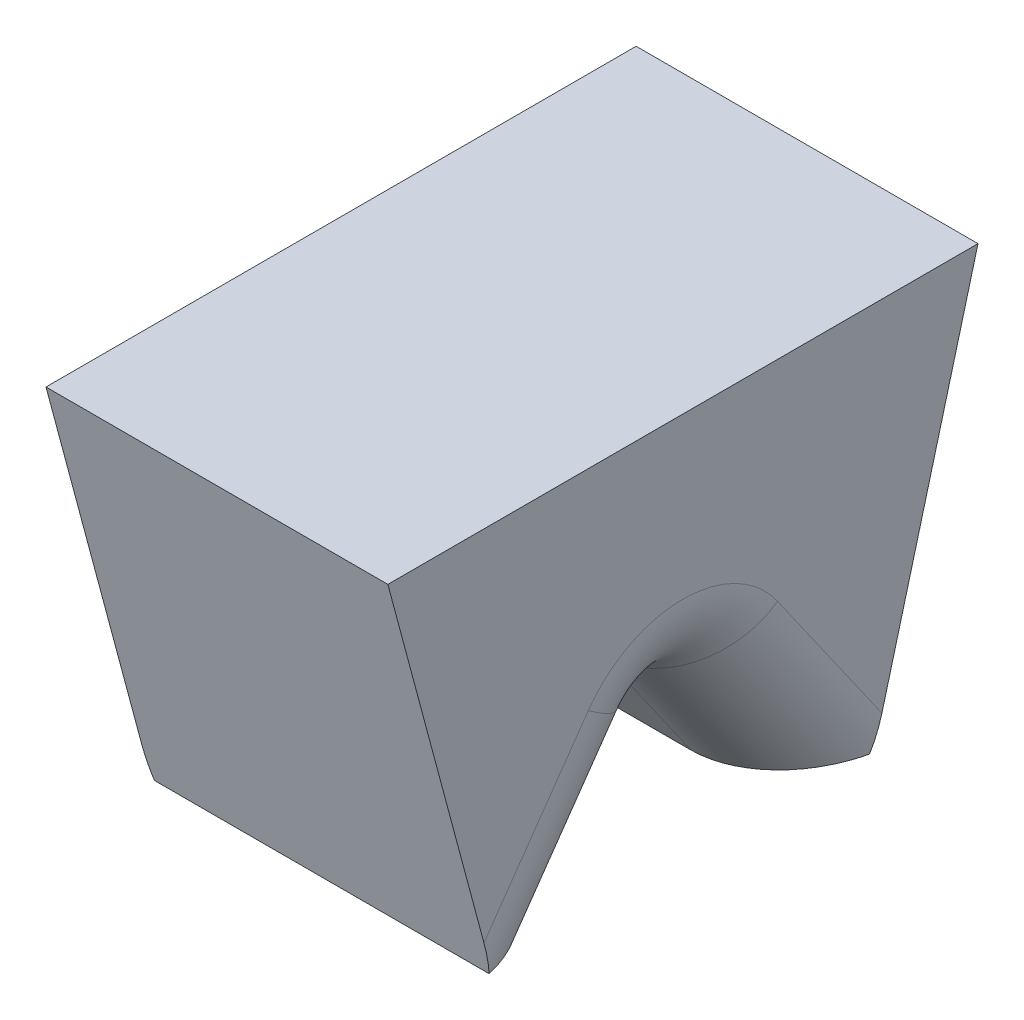
from build123d import *

# Parameters (mm, degrees)
SKETCH_TL_CUTTING_R    = 1.4986
TL_CUTTING_DEPTH       = 29.999999944
SKETCH_TDF_CUTTING_W   = 3.01719996
SKETCH_TDF_CUTTING_H   = 3.01719996
TDF_CUTTING_DEPTH      = 31.074766841
VW_VR_GRINDING_DEPTH   = 1.50859998
VW_VR_GRINDING_2_DEPTH = 1.50859998
ISA_GRINDING_DEPTH     = 1.50859998
SKETCH_PRE_FRX_BRX_W   = 1.39970002
SKETCH_PRE_FRX_BRX_H   = 0.4064
SKETCH_PRE_FRX_BRX_W_2 = 1.42715996
PRE_FRX_BRX_DEPTH      = 1.50859998
FA_BA_GRINDING_DEPTH   = 1.50859998
BR_EDM_R               = 0.0508
FR_EDM_R               = 0.0508


with BuildPart() as part:
    # sketch_TL_cutting → TL_cutting (new body)
    with BuildSketch(Plane(origin=(0, 0, 0), x_dir=(1, 0, 0), z_dir=(0, 1, 0))):
        with Locations(Location((0, 0, 0), (0, 0, 270))):
            Circle(SKETCH_TL_CUTTING_R)
    extrude(amount=TL_CUTTING_DEPTH)

    # sketch_TDF_cutting → TDF_cutting (cut, through all)
    with BuildSketch(Plane(origin=(0, 0, 0), x_dir=(1, 0, 0), z_dir=(0, 1, 0))):
        with Locations((-2.71001998, 0)):
            Rectangle(SKETCH_TDF_CUTTING_W, SKETCH_TDF_CUTTING_H)
    extrude(amount=TDF_CUTTING_DEPTH, mode=Mode.SUBTRACT)


with BuildPart() as body_2:
    # sketch_VW_VR_grinding → VW_VR_grinding (new, symmetric)
    with BuildSketch(Plane(origin=(0, 0, 0), x_dir=(0, 0, -1), z_dir=(1, 0, 0))):
        with BuildLine():
            Line((-1.49360001, -0.00999998), (-1.49360001, 0.395288914))
            ThreePointArc((-1.49360001, 0.395288914), (-1.493648337, 0.396395792), (-1.493792952, 0.397494246))
            Line((-1.493792952, 0.397494246), (-1.51859996, 0.538181782))
            Line((-1.51859996, 0.538181782), (-1.50859998, -0.00999998))
            Line((-1.50859998, -0.00999998), (-1.49360001, -0.00999998))
        make_face()
    extrude(amount=VW_VR_GRINDING_DEPTH, both=True)


with BuildPart() as body_3:
    # sketch_VW_VR_grinding → VW_VR_grinding 2 (new, symmetric)
    with BuildSketch(Plane(origin=(0, 0, 0), x_dir=(0, 0, -1), z_dir=(1, 0, 0))):
        with BuildLine():
            Line((1.49360001, -0.00999998), (1.49360001, 0.395288914))
            ThreePointArc((1.49360001, 0.395288914), (1.493648337, 0.396395792), (1.493792952, 0.397494246))
            Line((1.493792952, 0.397494246), (1.51859996, 0.538181782))
            Line((1.51859996, 0.538181782), (1.50859998, -0.00999998))
            Line((1.50859998, -0.00999998), (1.49360001, -0.00999998))
        make_face()
    extrude(amount=VW_VR_GRINDING_2_DEPTH, both=True)


    add(body_2.part)  # ISA_grinding merges body 2
    # sketch_ISA_grinding → ISA_grinding (add, symmetric)
    with BuildSketch(Plane(origin=(0, 0, 0), x_dir=(0, 0, -1), z_dir=(1, 0, 0))):
        Polygon((-0.10033, 0), (0.10033, 0), (1.50859998, 5.255735116), (1.50859998, -0.02999994), (-1.50859998, -0.02999994), (-1.50859998, 5.255735116), align=None)
    extrude(amount=ISA_GRINDING_DEPTH, both=True)

    # sketch_pre_FRX_BRX → pre_FRX_BRX (add, symmetric)
    with BuildSketch(Plane.XY):
        with Locations((0.79874999, 0.19320002)):
            Rectangle(SKETCH_PRE_FRX_BRX_W, SKETCH_PRE_FRX_BRX_H)
        with Locations((-0.80501998, 0.19320002)):
            Rectangle(SKETCH_PRE_FRX_BRX_W_2, SKETCH_PRE_FRX_BRX_H)
    extrude(amount=PRE_FRX_BRX_DEPTH, both=True)

    # sketch_FA_BA_grinding → FA_BA_grinding (add, symmetric)
    with BuildSketch(Plane.XY):
        Polygon((0.0889, -0.00999998), (0.0889, 0.4064), (1.6256, 11.340588652), (1.6256, -0.00999998), align=None)
        Polygon((-0.09144, -0.00999998), (-0.09144, 0.4064), (-1.32842, 9.207970039), (-1.32842, -0.00999998), align=None)
    extrude(amount=FA_BA_GRINDING_DEPTH, both=True)


with BuildPart() as part_1:
    add(part.part)

    # B1_fix: cut body 3
    add(body_3.part, mode=Mode.SUBTRACT)

    # V-Groove_EDM: sweep along a path in sketch_contour_V-Groove
    with BuildLine(Plane.XY) as v_groove_edm_path:
        Line((-1.20142, 0.07112), (1.4986, 0.07112))
    # sketch_section_V-Groove → V-Groove_EDM (sweep, cut)
    with BuildSketch(Plane(origin=(-1.20142, 0, -1.2954), x_dir=(0, 0, -1), z_dir=(1, 0, 0))):
        with BuildLine():
            Line((-1.287077415, 0.066787537), (-1.233310217, -0.00999998))
            Line((-1.233310217, -0.00999998), (-1.357489783, -0.00999998))
            Line((-1.357489783, -0.00999998), (-1.303722585, 0.066787537))
            ThreePointArc((-1.303722585, 0.066787537), (-1.2954, 0.07112), (-1.287077415, 0.066787537))
        make_face()
    sweep(path=v_groove_edm_path.line, mode=Mode.SUBTRACT)

    # BR_EDM
    br_edm_edges = [part_1.edges().sort_by_distance(p)[0] for p in [
        (-0.09144, 0.07112, 0),
        (-0.09144, 0.033393768, -0.031705153),
        (-0.09144, 0.033393768, 0.031705153),
    ]]
    fillet(br_edm_edges, radius=BR_EDM_R)

    # FR_EDM
    fr_edm_edges = [part_1.edges().sort_by_distance(p)[0] for p in [
        (0.0889, 0.033393768, -0.031705153),
        (0.0889, 0.033393768, 0.031705153),
        (0.0889, 0.07112, 0),
    ]]
    fillet(fr_edm_edges, radius=FR_EDM_R)

    # SurfaceCut1
    split(bisect_by=Plane(origin=(0, 0.206504065, 0), x_dir=(1, 0, 0), z_dir=(0, 1, 0)), keep=Keep.BOTTOM)


solid = part_1.part
